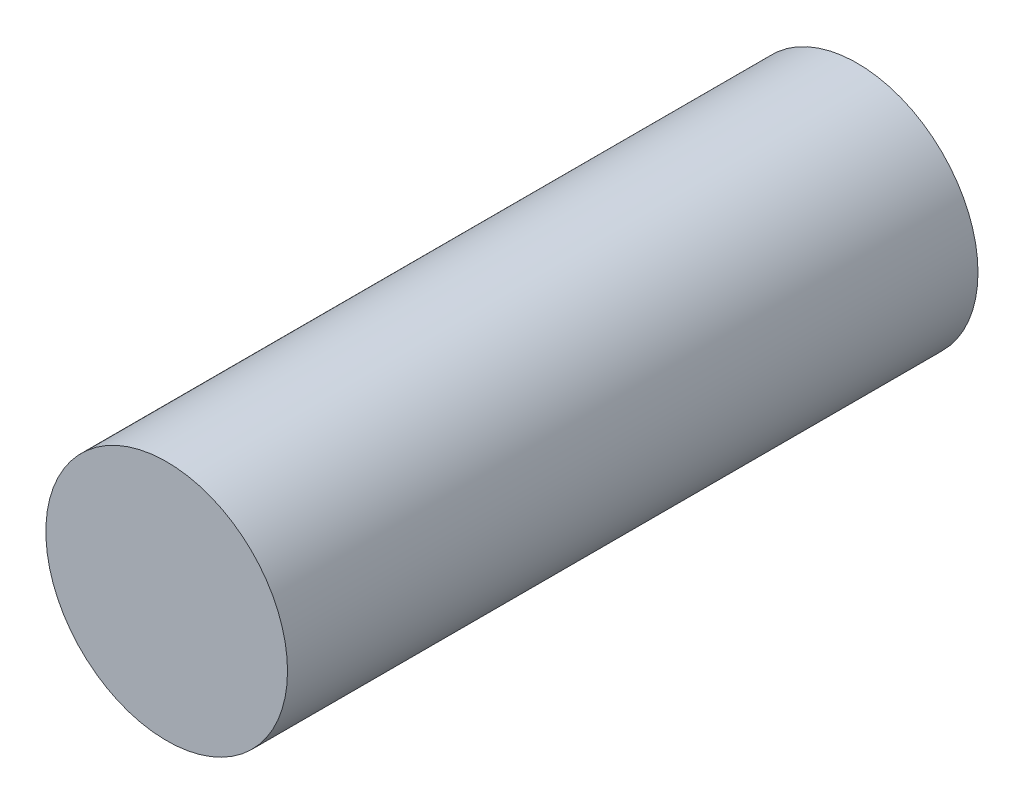
from build123d import *

# Parameters (mm, degrees)
SKETCH1_R           = 7
BOSS_EXTRUDE1_DEPTH = 40


with BuildPart() as part:
    # Sketch1 → Boss-Extrude1 (new body)
    with BuildSketch(Plane.XY):
        Circle(SKETCH1_R)
    extrude(amount=BOSS_EXTRUDE1_DEPTH)


solid = part.part
